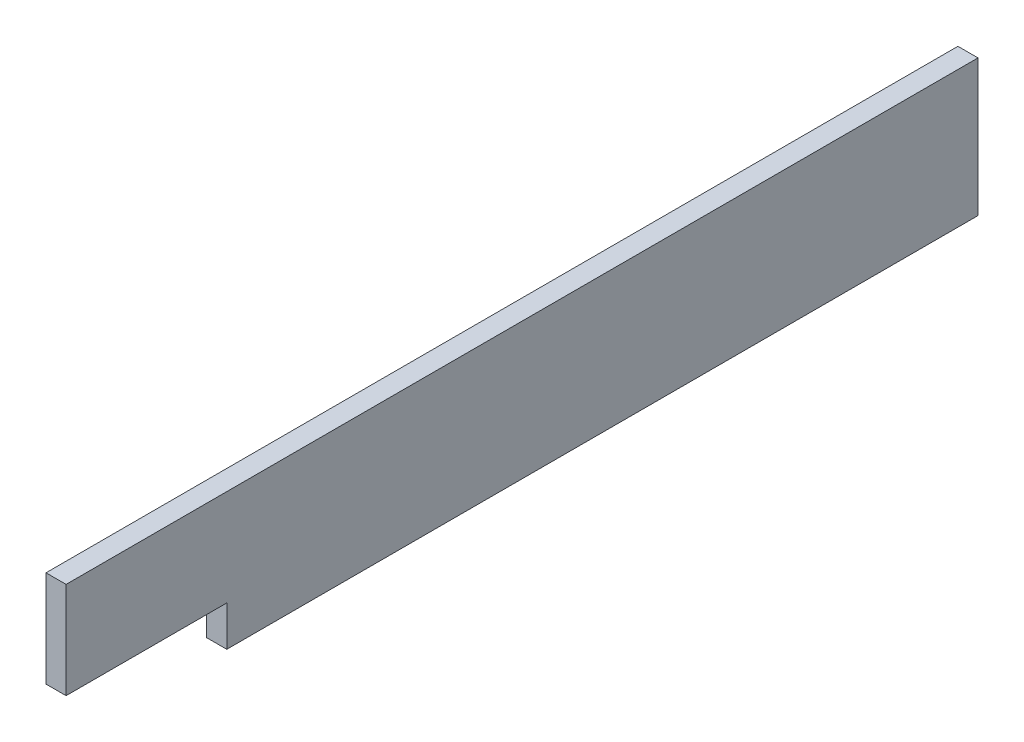
from build123d import *

# Parameters (mm, degrees)
SKETCH1_W           = 6.35
SKETCH1_H           = 43.18
BOSS_EXTRUDE1_DEPTH = 288.29
CUT_EXTRUDE1_REACH  = 293.575
SKETCH2_W           = 50.8
SKETCH2_H           = 12.7


with BuildPart() as part:
    # Sketch1 → Boss-Extrude1 (new body)
    with BuildSketch(Plane.XY):
        with Locations((3.175, 21.59)):
            Rectangle(SKETCH1_W, SKETCH1_H)
    extrude(amount=BOSS_EXTRUDE1_DEPTH)

    # Sketch2 → Cut-Extrude1 (cut, up to next)
    with BuildSketch(Plane.ZY, mode=Mode.PRIVATE) as cut_extrude1_sk1:
        with Locations((262.89, 6.35)):
            Rectangle(SKETCH2_W, SKETCH2_H)
    cut_extrude1_tool1 = extrude(cut_extrude1_sk1.sketch, amount=-CUT_EXTRUDE1_REACH, mode=Mode.PRIVATE) & part.part
    add(cut_extrude1_tool1.solids().sort_by_distance((0, 6.35, 262.89))[0], mode=Mode.SUBTRACT)


solid = part.part
